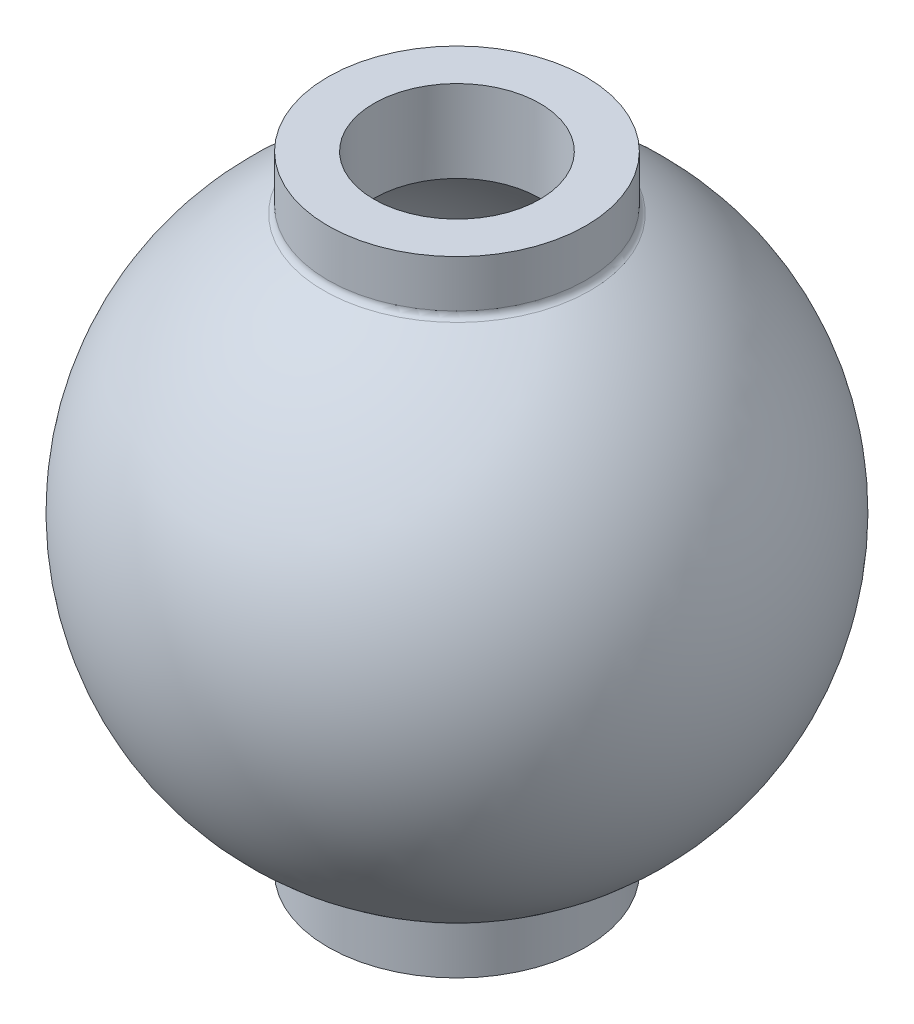
from build123d import *

# Parameters (mm, degrees)
CUT_EXTRUDE1_START  = -1120
SKETCH2_R           = 320
CUT_EXTRUDE1_DEPTH  = 1120
FILLET1_R           = 30
SKETCH4_R           = 300
BOSS_EXTRUDE1_DEPTH = 160


with BuildPart() as part:
    # Sketch1 → Revolve1 (revolve)
    with BuildSketch(Plane.XY, mode=Mode.PRIVATE) as revolve1_sk:
        with BuildLine():
            ThreePointArc((320, 1073.3126292), (161.693932008, 1108.266697303), (0, 1120))
            Line((0, 1120), (0, 942.9))
            ThreePointArc((0, 942.9), (942.9, 0), (0, -942.9))
            Line((0, -942.9), (0, -1120))
            ThreePointArc((0, -1120), (161.693932008, -1108.266697303), (320, -1073.3126292))
            ThreePointArc((320, -1073.3126292), (410.032559826, -1042.244357088), (497.1, -1003.639173209))
            ThreePointArc((497.1, -1003.639173209), (1120, 0), (497.1, 1003.639173209))
            ThreePointArc((497.1, 1003.639173209), (410.032559826, 1042.244357088), (320, 1073.3126292))
        make_face()
        with BuildLine():
            Line((497.1, 1203.639173209), (320, 1203.639173209))
            Line((320, 1203.639173209), (320, 1073.3126292))
            ThreePointArc((320, 1073.3126292), (410.032559826, 1042.244357088), (497.1, 1003.639173209))
            Line((497.1, 1003.639173209), (497.1, 1203.639173209))
        make_face()
        with BuildLine():
            Line((497.1, -1203.639173209), (497.1, -1003.639173209))
            ThreePointArc((497.1, -1003.639173209), (410.032559826, -1042.244357088), (320, -1073.3126292))
            Line((320, -1073.3126292), (320, -1203.639173209))
            Line((320, -1203.639173209), (497.1, -1203.639173209))
        make_face()
    revolve(revolve1_sk.sketch.rotate(Axis((0, 1478.863179405, 0), (0, -1, 0)), 90), axis=Axis((0, 1478.863179405, 0), (0, -1, 0)))

    # Sketch2 → Cut-Extrude1 (cut)
    with BuildSketch(Plane(origin=(0, 1203.639173209, 0), x_dir=(1, 0, 0), z_dir=(0, 1, 0)).offset(CUT_EXTRUDE1_START)):
        with Locations(Location((0, 0, 0), (0, 0, 270))):
            Circle(SKETCH2_R)
    extrude(amount=CUT_EXTRUDE1_DEPTH, mode=Mode.SUBTRACT)

    # Fillet1
    fillet1_edges = [part.edges().sort_by_distance(p)[0] for p in [
        (0, 1003.639173209, -497.1),
        (0, -1003.639173209, -497.1),
    ]]
    fillet(fillet1_edges, radius=FILLET1_R)

    # Sketch4 → Boss-Extrude1 (add)
    with BuildSketch(Plane.XZ.offset(1203.639173209)):
        with Locations(Location((0, 0, 0), (0, 0, 270))):
            Circle(SKETCH4_R)
    extrude(amount=-BOSS_EXTRUDE1_DEPTH)


solid = part.part
